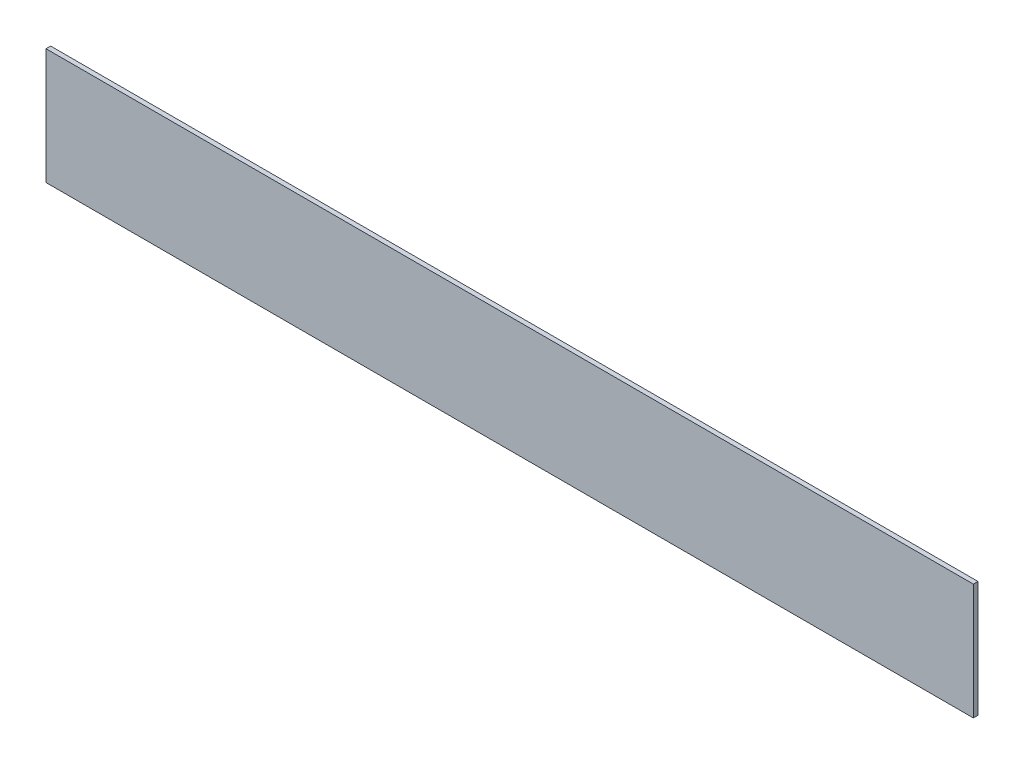
from build123d import *

# Parameters (mm, degrees)
KUTU_DUVAR_ARKA_1_START = -318.4
SKETCH1_W               = 320
SKETCH1_H               = 40
KUTU_DUVAR_ARKA_1_DEPTH = 1.6


with BuildPart() as part:
    # Sketch1 → KUTU_duvar_arka_1 (new body)
    with BuildSketch(Plane.XY.offset(KUTU_DUVAR_ARKA_1_START)):
        with Locations((160, 21.6)):
            Rectangle(SKETCH1_W, SKETCH1_H)
    extrude(amount=-KUTU_DUVAR_ARKA_1_DEPTH)


solid = part.part
